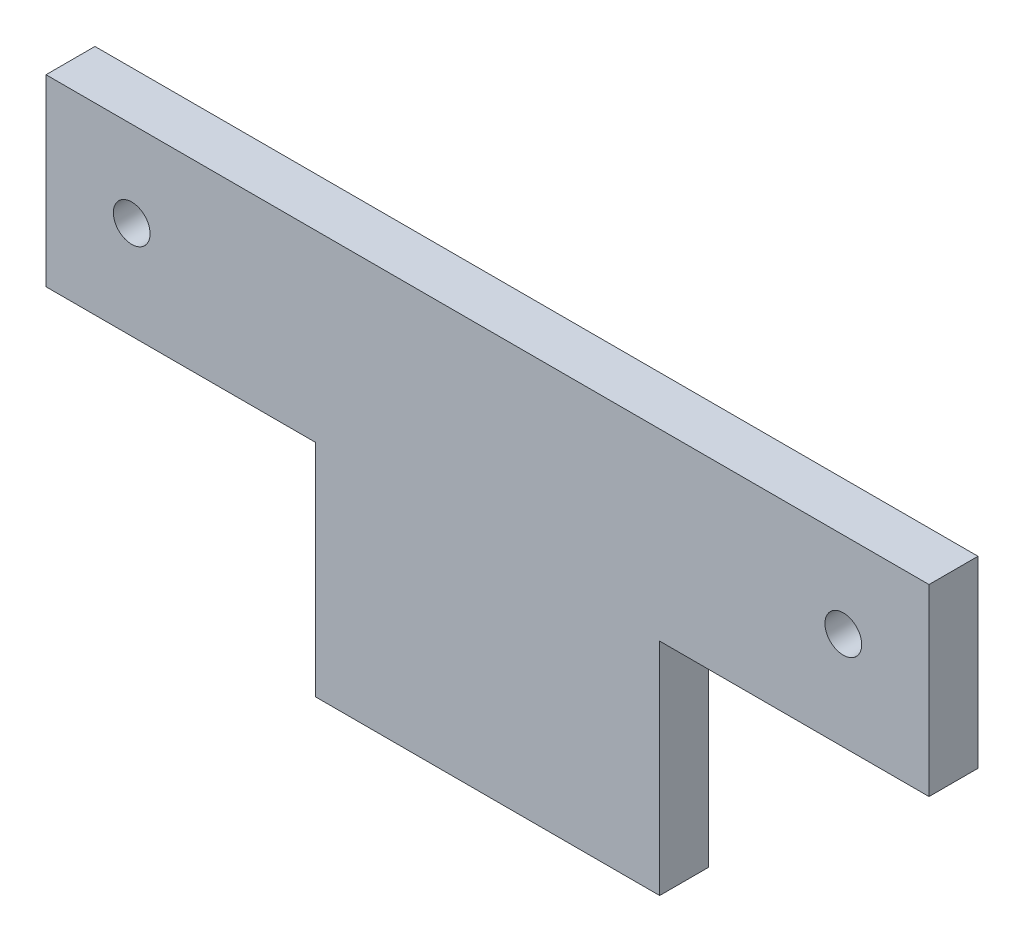
from build123d import *

# Parameters (mm, degrees)
SKETCH_1_R      = 1.5
EXTRUDE_1_DEPTH = 4


with BuildPart() as part:
    # 草图1 → 凸台-拉伸1 (new body)
    with BuildSketch(Plane.XY):
        Polygon((-7, 7), (65.12, 7), (65.12, -8), (43.12, -8), (43.12, -26), (15, -26), (15, -8), (-7, -8), align=None)
        Circle(SKETCH_1_R, mode=Mode.SUBTRACT)
        with Locations((58.12, 0)):
            Circle(SKETCH_1_R, mode=Mode.SUBTRACT)
    extrude(amount=EXTRUDE_1_DEPTH)


solid = part.part
